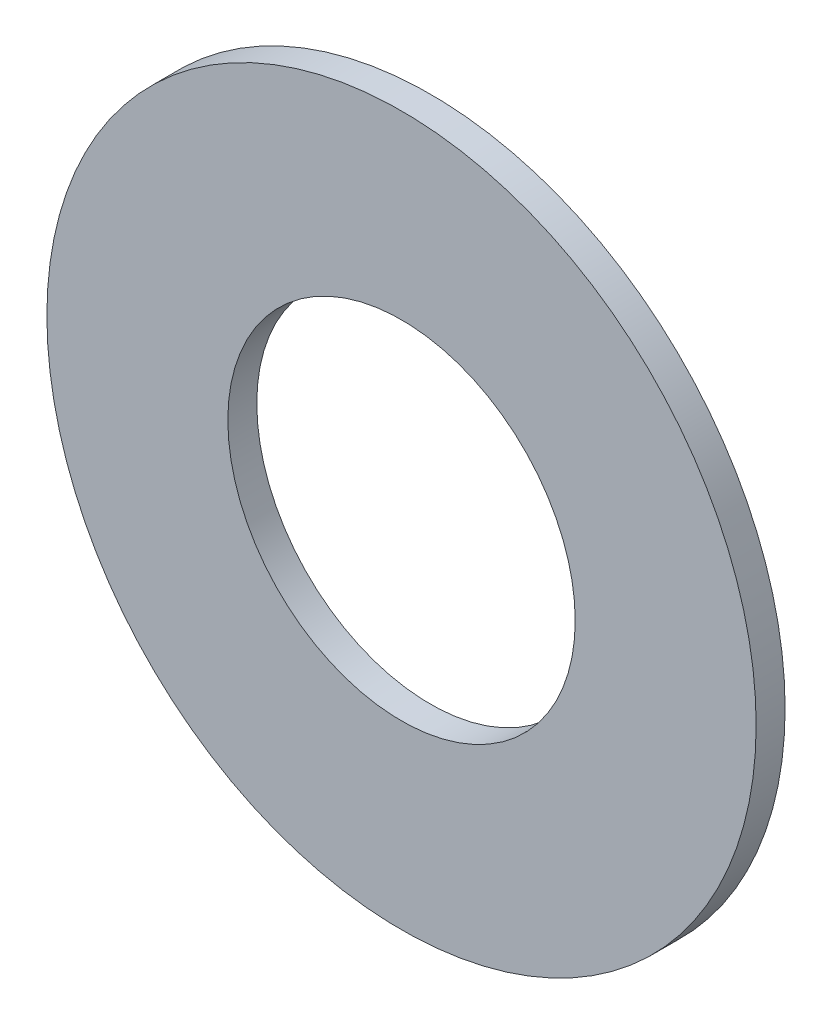
from build123d import *

# Parameters (mm, degrees)
SKETCH_2_R      = 12.25
SKETCH_2_R_2    = 6
EXTRUDE_1_DEPTH = 1


with BuildPart() as part:
    # 草图2 → 凸台-拉伸1 (new body)
    with BuildSketch(Plane.XY):
        Circle(SKETCH_2_R)
        Circle(SKETCH_2_R_2, mode=Mode.SUBTRACT)
    extrude(amount=EXTRUDE_1_DEPTH)


solid = part.part
